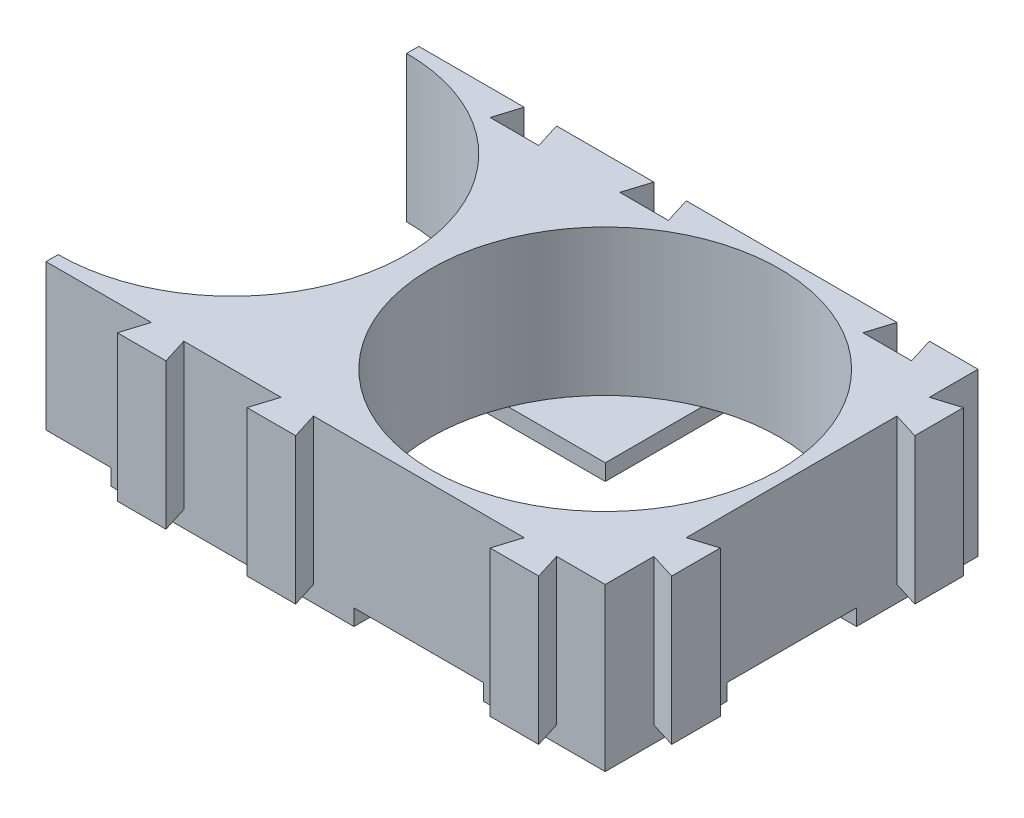
from build123d import *

# Parameters (mm, degrees)
SKETCH1_W           = 47.6
SKETCH1_H           = 24.6
BOSS_EXTRUDE1_DEPTH = 10
SKETCH2_R           = 10.75
CUT_EXTRUDE1_DEPTH  = 9
CUT_EXTRUDE2_DEPTH  = 9
SKETCH5_W           = 1.6
SKETCH5_H           = 24.6
CUT_EXTRUDE3_DEPTH  = 10
SKETCH6_W           = 46
SKETCH6_H           = 1.6
CUT_EXTRUDE4_DEPTH  = 10
BOSS_EXTRUDE2_DEPTH = 9
SKETCH10_W          = 46
SKETCH10_H          = 8.003908937
CUT_EXTRUDE5_DEPTH  = 1
SKETCH11_W          = 8
SKETCH11_H          = 23
CUT_EXTRUDE6_DEPTH  = 1
SKETCH12_W          = 11.5
SKETCH12_H          = 24.6
CUT_EXTRUDE7_DEPTH  = 10


with BuildPart() as part:
    # Sketch1 → Boss-Extrude1 (new body)
    with BuildSketch(Plane(origin=(0, 0, 0), x_dir=(1, 0, 0), z_dir=(0, 1, 0))):
        with Locations((23.8, 12.3)):
            Rectangle(SKETCH1_W, SKETCH1_H)
    extrude(amount=BOSS_EXTRUDE1_DEPTH)

    # Sketch2 → Cut-Extrude1 (cut)
    with BuildSketch(Plane(origin=(0, 10, 0), x_dir=(1, 0, 0), z_dir=(0, 1, 0))):
        with Locations(Location((11.5, 13.1, 0), (0, 0, 270))):
            Circle(SKETCH2_R)
        with Locations(Location((34.5, 13.1, 0), (0, 0, 270))):
            Circle(SKETCH2_R)
    extrude(amount=-CUT_EXTRUDE1_DEPTH, mode=Mode.SUBTRACT)

    # Sketch3 → Cut-Extrude2 (cut)
    with BuildSketch(Plane(origin=(0, 10, 0), x_dir=(1, 0, 0), z_dir=(0, 1, 0))):
        Polygon((3, 24.6), (2.5, 23), (5.5, 23), (5, 24.6), align=None)
        Polygon((18, 24.6), (17.5, 23), (20.5, 23), (20, 24.6), align=None)
        Polygon((26, 24.6), (25.5, 23), (28.5, 23), (28, 24.6), align=None)
        Polygon((41, 24.6), (40.5, 23), (43.5, 23), (43, 24.6), align=None)
        Polygon((0, 21.6), (1.6, 22.1), (1.6, 19.1), (0, 19.6), align=None)
        Polygon((0, 6.6), (1.6, 7.1), (1.6, 4.1), (0, 4.6), align=None)
    extrude(amount=-CUT_EXTRUDE2_DEPTH, mode=Mode.SUBTRACT)

    # Sketch5 → Cut-Extrude3 (cut)
    with BuildSketch(Plane(origin=(0, 10, 0), x_dir=(1, 0, 0), z_dir=(0, 1, 0))):
        with Locations((46.8, 12.3)):
            Rectangle(SKETCH5_W, SKETCH5_H)
    extrude(amount=-CUT_EXTRUDE3_DEPTH, mode=Mode.SUBTRACT)

    # Sketch6 → Cut-Extrude4 (cut)
    with BuildSketch(Plane(origin=(0, 10, 0), x_dir=(1, 0, 0), z_dir=(0, 1, 0))):
        with Locations((23, 0.8)):
            Rectangle(SKETCH6_W, SKETCH6_H)
    extrude(amount=-CUT_EXTRUDE4_DEPTH, mode=Mode.SUBTRACT)

    # Sketch7 → Boss-Extrude2 (add)
    with BuildSketch(Plane(origin=(0, 10, 0), x_dir=(1, 0, 0), z_dir=(0, 1, 0))):
        Polygon((46, 21.6), (47.6, 22.1), (47.6, 19.1), (46, 19.6), align=None)
        Polygon((46, 6.6), (47.6, 7.1), (47.6, 4.1), (46, 4.6), align=None)
        Polygon((3, 1.6), (2.5, 0), (5.5, 0), (5, 1.6), align=None)
        Polygon((18, 1.6), (17.5, 0), (20.5, 0), (20, 1.6), align=None)
        Polygon((26, 1.6), (25.5, 0), (28.5, 0), (28, 1.6), align=None)
        Polygon((41, 1.6), (40.5, 0), (43.5, 0), (43, 1.6), align=None)
    extrude(amount=-BOSS_EXTRUDE2_DEPTH)

    # Sketch10 → Cut-Extrude5 (cut)
    with BuildSketch(Plane.XZ):
        with Locations((23, -13.101954469)):
            Rectangle(SKETCH10_W, SKETCH10_H)
    extrude(amount=-CUT_EXTRUDE5_DEPTH, mode=Mode.SUBTRACT)

    # Sketch11 → Cut-Extrude6 (cut)
    with BuildSketch(Plane.XZ):
        with Locations((11.5, -13.1)):
            Rectangle(SKETCH11_W, SKETCH11_H)
        with Locations((34.5, -13.1)):
            Rectangle(SKETCH11_W, SKETCH11_H)
    extrude(amount=-CUT_EXTRUDE6_DEPTH, mode=Mode.SUBTRACT)

    # Sketch12 → Cut-Extrude7 (cut)
    with BuildSketch(Plane(origin=(0, 10, 0), x_dir=(1, 0, 0), z_dir=(0, 1, 0))):
        with Locations((5.75, 12.3)):
            Rectangle(SKETCH12_W, SKETCH12_H)
    extrude(amount=-CUT_EXTRUDE7_DEPTH, mode=Mode.SUBTRACT)


solid = part.part
